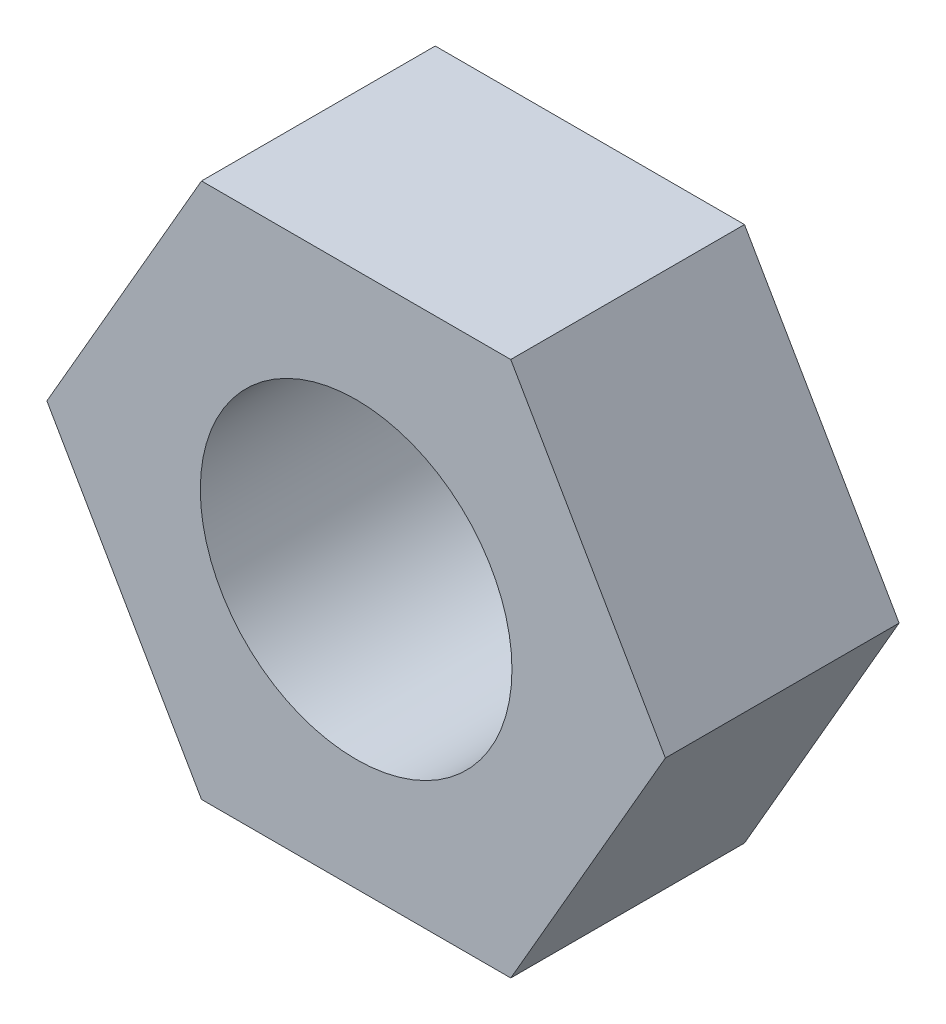
from build123d import *

# Parameters (mm, degrees)
SKETCH_1_R      = 1.6
EXTRUDE_1_DEPTH = 1.2


with BuildPart() as part:
    # 草图1 → 凸台-拉伸1 (new, symmetric)
    with BuildSketch(Plane.XY):
        Polygon((3.175426481, 0), (1.58771324, 2.75), (-1.58771324, 2.75), (-3.175426481, 0), (-1.58771324, -2.75), (1.58771324, -2.75), align=None)
        Circle(SKETCH_1_R, mode=Mode.SUBTRACT)
    extrude(amount=EXTRUDE_1_DEPTH, both=True)


solid = part.part
